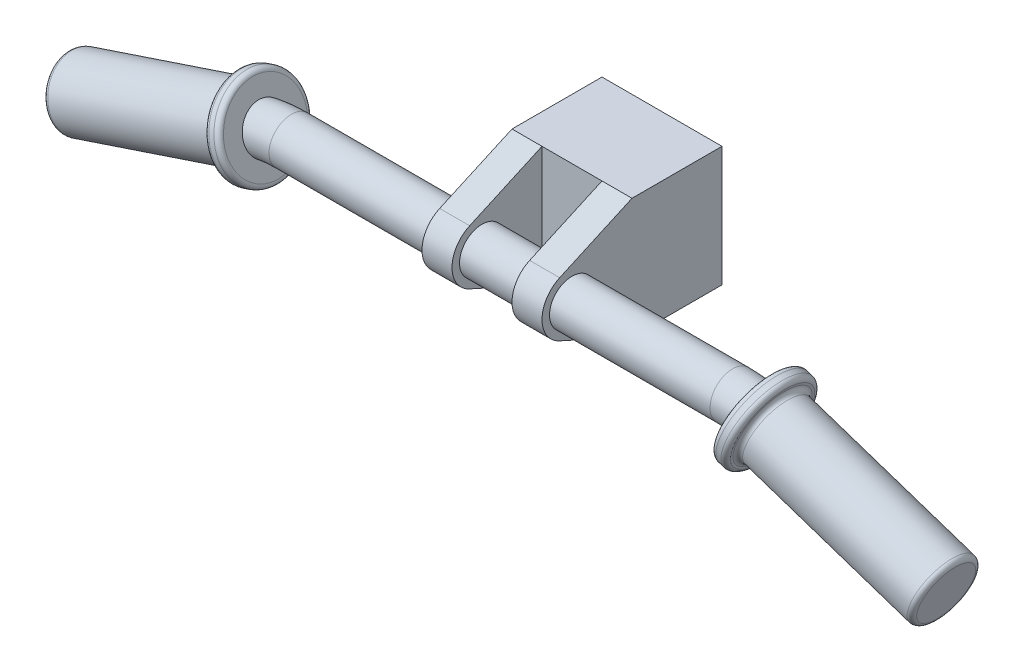
from build123d import *

# Parameters (mm, degrees)
SKETCH1_W            = 6.35
SKETCH1_H            = 6.35
BOSS_EXTRUDE1_DEPTH  = 4.7625
SKETCH3_R            = 1.5875
BOSS_EXTRUDE2_DEPTH  = 1.5875
BOSS_EXTRUDE3_START  = -1.5875
SKETCH4_R            = 1.5875
BOSS_EXTRUDE3_DEPTH  = 1.5875
SKETCH5_R            = 1.190625
BOSS_EXTRUDE4_START  = -8.89
SKETCH7_R            = 1.74625
BOSS_EXTRUDE4_DEPTH  = 9.68375
SKETCH8_R            = 2.38125
BOSS_EXTRUDE5_DEPTH  = 0.79375
FILLET2_R            = 0.254
FILLET3_R            = 0.254
FILLET4_R            = 0.254
FILLET2_OF_MIRROR3_R = 0.254
FILLET3_OF_MIRROR3_R = 0.254
FILLET4_OF_MIRROR3_R = 0.254


with BuildPart() as part:
    # Sketch1 → Boss-Extrude1 (new body)
    with BuildSketch(Plane.XY):
        with Locations((1.55575, 0.635)):
            Rectangle(SKETCH1_W, SKETCH1_H)
    extrude(amount=BOSS_EXTRUDE1_DEPTH)

    # Sketch3 → Boss-Extrude2 (add)
    with BuildSketch(Plane(origin=(4.73075, 0, 0), x_dir=(0, 0, -1), z_dir=(1, 0, 0))):
        with Locations((-7.9375, 0.635)):
            Circle(SKETCH3_R)
        with BuildLine():
            Line((-4.7625, -2.54), (-4.7625, 3.81))
            Line((-4.7625, 3.81), (-8.590657552, 2.081907552))
            ThreePointArc((-8.590657552, 2.081907552), (-7.076318069, 1.968612362), (-6.35, 0.635))
            ThreePointArc((-6.35, 0.635), (-7.076318069, -0.698612362), (-8.590657552, -0.811907552))
            Line((-8.590657552, -0.811907552), (-4.7625, -2.54))
        make_face()
    extrude(amount=-BOSS_EXTRUDE2_DEPTH)

    # Sketch4 → Boss-Extrude3 (add)
    with BuildSketch(Plane.ZY.offset(1.61925).offset(BOSS_EXTRUDE3_START)):
        with BuildLine():
            Line((4.7625, -2.54), (8.590657552, -0.811907552))
            ThreePointArc((8.590657552, -0.811907552), (6.35, 0.635), (8.590657552, 2.081907552))
            Line((8.590657552, 2.081907552), (4.7625, 3.81))
            Line((4.7625, 3.81), (4.7625, -2.54))
        make_face()
        with Locations((7.9375, 0.635)):
            Circle(SKETCH4_R)
    extrude(amount=BOSS_EXTRUDE3_DEPTH)

    # Sweep1: sweep along a path in Sketch6
    with BuildLine(Plane.XY.offset(7.9375)) as sweep1_path:
        Line((-1.61925, 0.635), (4.73075, 0.635))
        Line((4.73075, 0.635), (13.225286858, 0.635))
        ThreePointArc((13.225286858, 0.635), (14.242444101, 0.553005356), (15.233333172, 0.309138943))
        Line((15.233333172, 0.309138943), (23.78075, -2.54))
    # Sketch5 → Sweep1 (sweep)
    with BuildSketch(Plane.ZY.offset(1.61925)):
        with Locations((7.9375, 0.635)):
            Circle(SKETCH5_R)
    sweep1 = sweep(path=sweep1_path.line)

    # Mirror1: Sweep1 across plane
    add(sweep1.mirror(Plane.ZY.offset(-1.55575)))

    # Sketch7 → Boss-Extrude4 (add)
    with BuildSketch(Plane(origin=(22.164675, -7.388225, 0), x_dir=(0, 0, -1), z_dir=(0.9486832980505139, -0.31622776601683794, 0)).offset(BOSS_EXTRUDE4_START)):
        with Locations(Location((-7.9375, 5.11047787, 0), (0, 0, 90))):
            Circle(SKETCH7_R)
    boss_extrude4 = extrude(amount=BOSS_EXTRUDE4_DEPTH)

    # Sketch8 → Boss-Extrude5 (add)
    with BuildSketch(Plane(origin=(13.73088048, -4.57696016, 0), x_dir=(0, 0, 1), z_dir=(-0.9486832980505139, 0.316227766016838, 0))):
        with Locations(Location((7.9375, 5.11047787, 0), (0, 0, 90))):
            Circle(SKETCH8_R)
    boss_extrude5 = extrude(amount=BOSS_EXTRUDE5_DEPTH)

    # Fillet2
    fillet2_edges = [part.edges().sort_by_distance(p)[0] for p in [
        (23.981554631, -4.447643998, 7.9375),
    ]]
    fillet(fillet2_edges, radius=FILLET2_R)

    # Fillet3
    fillet3_edges = [part.edges().sort_by_distance(p)[0] for p in [
        (14.794742744, -1.385373369, 7.9375),
    ]]
    fillet(fillet3_edges, radius=FILLET3_R)

    # Fillet4
    fillet4_edges = [part.edges().sort_by_distance(p)[0] for p in [
        (13.840920745, -1.736781474, 7.9375),
        (14.593938113, -1.987787264, 7.9375),
    ]]
    fillet(fillet4_edges, radius=FILLET4_R)

    # Mirror3: Boss-Extrude4, Boss-Extrude5 across plane
    add(boss_extrude4.mirror(Plane.ZY.offset(-1.55575)))
    add(boss_extrude5.mirror(Plane.ZY.offset(-1.55575)))

    # Fillet2 of Mirror3
    fillet2_of_mirror3_edges = [part.edges().sort_by_distance(p)[0] for p in [
        (-20.870054631, -4.447643998, 7.9375),
    ]]
    fillet(fillet2_of_mirror3_edges, radius=FILLET2_OF_MIRROR3_R)

    # Fillet3 of Mirror3
    fillet3_of_mirror3_edges = [part.edges().sort_by_distance(p)[0] for p in [
        (-11.683242744, -1.385373369, 7.9375),
    ]]
    fillet(fillet3_of_mirror3_edges, radius=FILLET3_OF_MIRROR3_R)

    # Fillet4 of Mirror3
    fillet4_of_mirror3_edges = [part.edges().sort_by_distance(p)[0] for p in [
        (-10.729420745, -1.736781474, 7.9375),
        (-11.482438113, -1.987787264, 7.9375),
    ]]
    fillet(fillet4_of_mirror3_edges, radius=FILLET4_OF_MIRROR3_R)


solid = part.part
